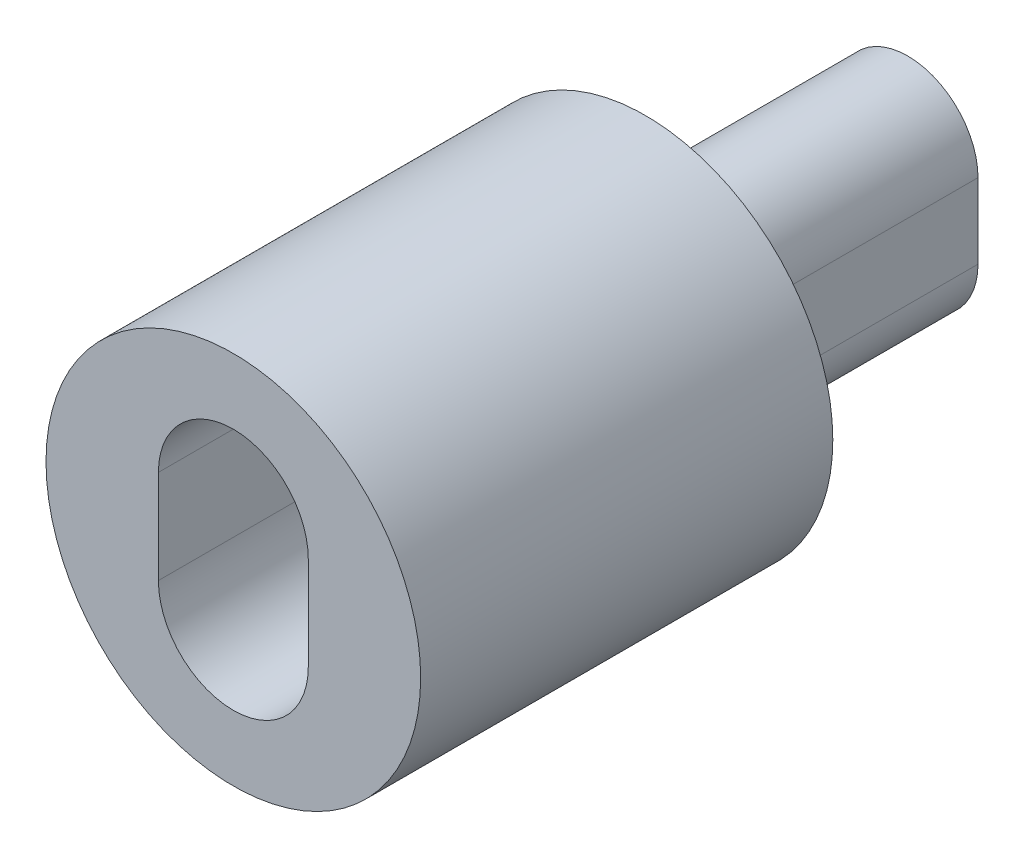
from build123d import *

# Parameters (mm, degrees)
SKETCH1_R           = 5
BOSS_EXTRUDE1_DEPTH = 11
CUT_EXTRUDE1_DEPTH  = 8
BOSS_EXTRUDE2_DEPTH = 7


with BuildPart() as part:
    # Sketch1 → Boss-Extrude1 (new body)
    with BuildSketch(Plane.XY):
        with Locations((-12.317334514, -23.116112266)):
            Circle(SKETCH1_R)
    extrude(amount=BOSS_EXTRUDE1_DEPTH)

    # Sketch2 → Cut-Extrude1 (cut)
    with BuildSketch(Plane.XY.offset(11)):
        with BuildLine():
            Line((-14.317334514, -24.366112266), (-14.317334514, -21.866112266))
            ThreePointArc((-14.317334514, -21.866112266), (-12.317334514, -19.866112266), (-10.317334514, -21.866112266))
            Line((-10.317334514, -21.866112266), (-10.317334514, -24.366112266))
            ThreePointArc((-10.317334514, -24.366112266), (-12.317334514, -26.366112266), (-14.317334514, -24.366112266))
        make_face()
    extrude(amount=-CUT_EXTRUDE1_DEPTH, mode=Mode.SUBTRACT)

    # Sketch4 → Boss-Extrude2 (add)
    with BuildSketch(Plane(origin=(0, 0, 0), x_dir=(-1, 0, 0), z_dir=(0, 0, -1))):
        with BuildLine():
            Line((10.442334514, -24.116112266), (10.442334514, -22.116112266))
            ThreePointArc((10.442334514, -22.116112266), (12.317334514, -20.241112266), (14.192334514, -22.116112266))
            Line((14.192334514, -22.116112266), (14.192334514, -24.116112266))
            ThreePointArc((14.192334514, -24.116112266), (12.317334514, -25.991112266), (10.442334514, -24.116112266))
        make_face()
    extrude(amount=BOSS_EXTRUDE2_DEPTH)


solid = part.part
